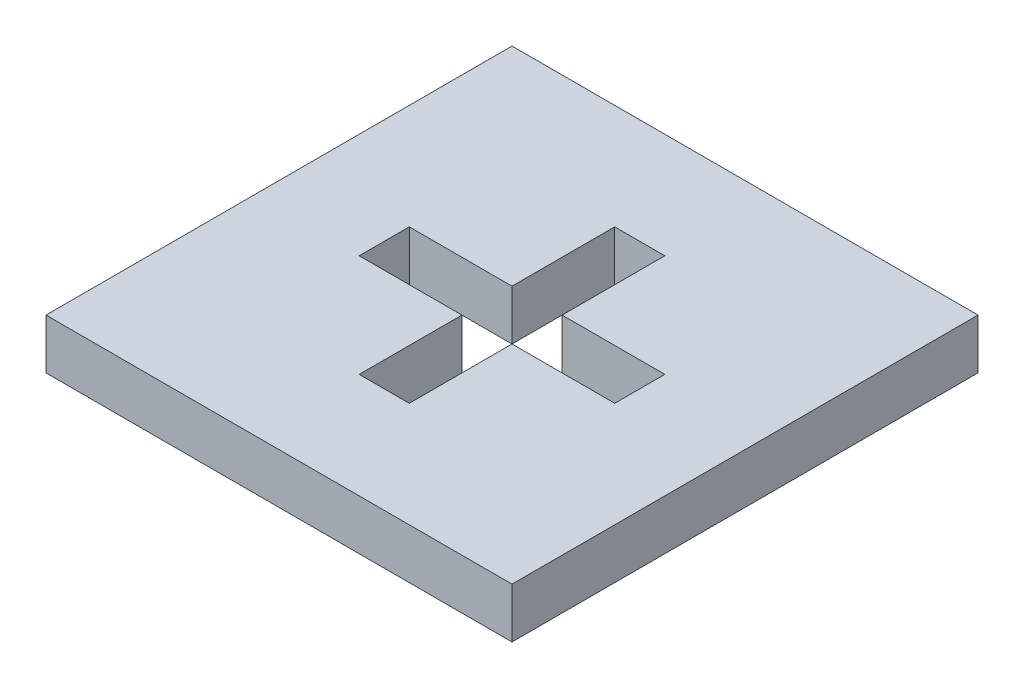
from build123d import *

# Parameters (mm, degrees)
SKETCH1_W           = 50.8
SKETCH1_H           = 50.8
BOSS_EXTRUDE1_DEPTH = 5.461
CUT_EXTRUDE1_DEPTH  = 5.461


with BuildPart() as part:
    # Sketch1 → Boss-Extrude1 (new body)
    with BuildSketch(Plane(origin=(0, 0, 0), x_dir=(1, 0, 0), z_dir=(0, 1, 0))):
        with Locations((25.4, 25.4)):
            Rectangle(SKETCH1_W, SKETCH1_H)
    extrude(amount=BOSS_EXTRUDE1_DEPTH)

    # Sketch2 → Cut-Extrude1 (cut)
    with BuildSketch(Plane(origin=(0, 5.461, 0), x_dir=(1, 0, 0), z_dir=(0, 1, 0))):
        Polygon((28.1305, 28.1305), (39.327666667, 28.1305), (39.327666667, 22.6695), (28.1305, 22.6695), (28.1305, 11.472333333), (22.6695, 11.472333333), (22.6695, 22.6695), (11.472333333, 22.6695), (11.472333333, 28.1305), (22.6695, 28.1305), (22.6695, 39.327666667), (28.1305, 39.327666667), align=None)
    extrude(amount=-CUT_EXTRUDE1_DEPTH, mode=Mode.SUBTRACT)


solid = part.part
